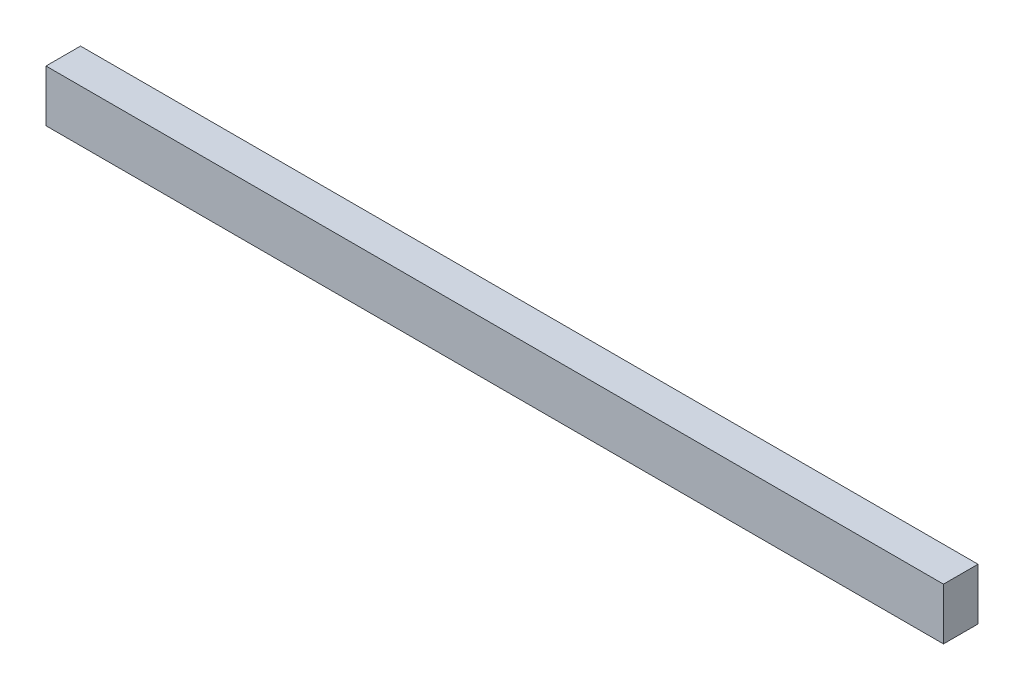
from build123d import *

# Parameters (mm, degrees)
SKETCH2_W           = 26
SKETCH2_H           = 1.5
BOSS_EXTRUDE1_DEPTH = 1


with BuildPart() as part:
    # Sketch2 → Boss-Extrude1 (new body)
    with BuildSketch(Plane.XY):
        with Locations((13, 0.75)):
            Rectangle(SKETCH2_W, SKETCH2_H)
    extrude(amount=BOSS_EXTRUDE1_DEPTH)


solid = part.part
